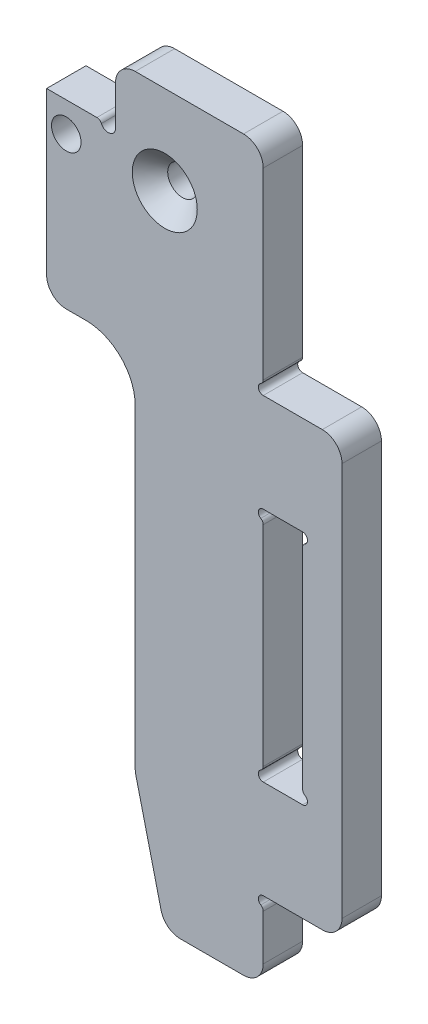
from build123d import *

# Parameters (mm, degrees)
SKETCH_1_W          = 15
SKETCH_1_H          = 6
SKETCH_1_W_2        = 25
SKETCH_1_R          = 1.5
SKETCH_1_W_3        = 4
SKETCH_1_H_2        = 10
EXTRUDE_1_DEPTH     = 4
CUT_EXTRUDE_1_DEPTH = 4
CHAMFER_1_SIZE      = 1.8
SKETCH_3_W          = 4
SKETCH_3_H          = 44
EXTRUDE_2_DEPTH     = 4
CUT_EXTRUDE_2_DEPTH = 4
FILLET_1_R          = 0.5
SKETCH_12_W         = 3
SKETCH_12_H         = 18.4
CUT_EXTRUDE_6_DEPTH = 10
CUT_EXTRUDE_7_DEPTH = 10
FILLET_2_R          = 5
FILLET_3_R          = 2


with BuildPart() as part:
    # 草图1 → 凸台-拉伸1 (new body)
    # profile 1 of 5: a face of its own
    with BuildSketch(Plane.XY):
        with Locations((12.5, 6)):
            Rectangle(SKETCH_1_W, SKETCH_1_H)
    # profile 2 of 5: a face of its own
    with BuildSketch(Plane.XY):
        with Locations((7.5, 0)):
            Rectangle(SKETCH_1_W_2, SKETCH_1_H)
        Circle(SKETCH_1_R, mode=Mode.SUBTRACT)
        with Locations((10, 0)):
            Circle(SKETCH_1_R, mode=Mode.SUBTRACT)
    # profile 3 of 5: a face of its own
    with BuildSketch(Plane.XY):
        Polygon((10, -65), (20, -65), (20, -3), (-5, -3), align=None)
    # profile 4 of 5: a face of its own
    with BuildSketch(Plane.XY):
        with Locations((22, -18)):
            Rectangle(SKETCH_1_W_3, SKETCH_1_H_2)
    # profile 5 of 5: a face of its own
    with BuildSketch(Plane.XY):
        with Locations((22, -52)):
            Rectangle(SKETCH_1_W_3, SKETCH_1_H_2)
    extrude(amount=EXTRUDE_1_DEPTH)

    # 草图2 → 切除-拉伸1 (cut)
    with BuildSketch(Plane.XY.offset(4)):
        with BuildLine():
            Line((20, -13), (20, -12))
            ThreePointArc((20, -12), (19.5, -12.5), (20, -13))
        make_face()
        with BuildLine():
            Line((20, -24), (20, -23))
            ThreePointArc((20, -23), (19.5, -23.5), (20, -24))
        make_face()
        with BuildLine():
            Line((20, -47), (20, -46))
            ThreePointArc((20, -46), (19.5, -46.5), (20, -47))
        make_face()
        with BuildLine():
            Line((20, -58), (20, -57))
            ThreePointArc((20, -57), (19.5, -57.5), (20, -58))
        make_face()
        with BuildLine():
            ThreePointArc((3.5, 3), (4.25, 2.25), (5, 3))
            Line((5, 3), (3.5, 3))
        make_face()
    extrude(amount=-CUT_EXTRUDE_1_DEPTH, mode=Mode.SUBTRACT)

    # 倒角1
    chamfer_1_edges = [part.edges().sort_by_distance(p)[0] for p in [
        (8.5, 0, 4),
    ]]
    chamfer(chamfer_1_edges, length=CHAMFER_1_SIZE)

    # 草图3 → 凸台-拉伸2 (add)
    with BuildSketch(Plane.XY.offset(4)):
        with Locations((26, -35)):
            Rectangle(SKETCH_3_W, SKETCH_3_H)
    extrude(amount=-EXTRUDE_2_DEPTH)

    # 草图4 → 切除-拉伸2 (cut)
    with BuildSketch(Plane.XY.offset(4)):
        with BuildLine():
            Line((24, -23), (24, -24))
            ThreePointArc((24, -24), (24.5, -23.5), (24, -23))
        make_face()
        with BuildLine():
            Line((24, -46), (24, -47))
            ThreePointArc((24, -47), (24.5, -46.5), (24, -46))
        make_face()
    extrude(amount=-CUT_EXTRUDE_2_DEPTH, mode=Mode.SUBTRACT)

    # 圆角1
    fillet_1_edges = [part.edges().sort_by_distance(p)[0] for p in [
        (24, -24, 2),
        (24, -46, 2),
        (20, -24, 2),
        (20, -46, 2),
        (20, -58, 2),
        (3.5, 3, 2),
        (20, -12, 2),
    ]]
    fillet(fillet_1_edges, radius=FILLET_1_R)

    # 草图12 → 切除-拉伸6 (cut)
    with BuildSketch(Plane.XY.offset(4)):
        with Locations((-3.5, -6.2)):
            Rectangle(SKETCH_12_W, SKETCH_12_H)
    extrude(amount=-CUT_EXTRUDE_6_DEPTH, mode=Mode.SUBTRACT)

    # 草图13 → 切除-拉伸7 (cut)
    with BuildSketch(Plane.XY.offset(4)):
        Polygon((7, -52.6), (-2, -15.4), (7, -15.4), align=None)
    extrude(amount=-CUT_EXTRUDE_7_DEPTH, mode=Mode.SUBTRACT)

    # 圆角2
    fillet_2_edges = [part.edges().sort_by_distance(p)[0] for p in [
        (7, -15.4, 2),
    ]]
    fillet(fillet_2_edges, radius=FILLET_2_R)

    # 圆角3
    fillet_3_edges = [part.edges().sort_by_distance(p)[0] for p in [
        (28, -13, 2),
        (28, -57, 2),
        (-2, -15.4, 2),
        (7, -52.6, 2),
        (5, 9, 2),
        (20, 9, 2),
        (20, -65, 2),
        (10, -65, 2),
    ]]
    fillet(fillet_3_edges, radius=FILLET_3_R)


solid = part.part
